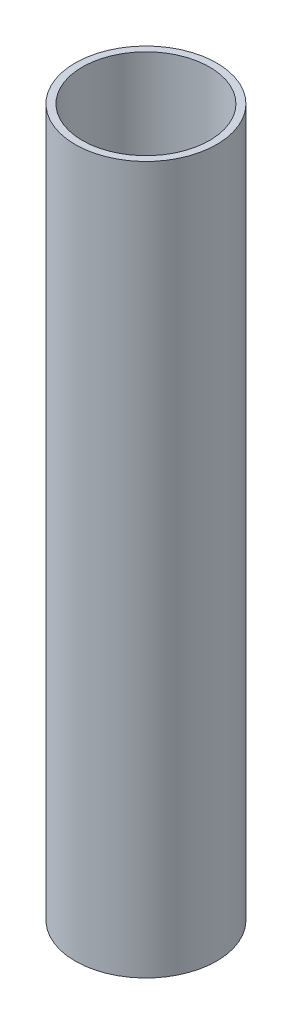
from build123d import *

# Parameters (mm, degrees)
SKETCH_1_R          = 5
EXTRUDE_1_DEPTH     = 50
SKETCH_3_R          = 4.5
CUT_EXTRUDE_1_DEPTH = 61.939229807


with BuildPart() as part:
    # 草图1 → 凸台-拉伸1 (new body)
    with BuildSketch(Plane(origin=(0, 0, 0), x_dir=(1, 0, 0), z_dir=(0, 1, 0))):
        with Locations(Location((-19.389643608, 19.874384698, 0), (0, 0, 270))):
            Circle(SKETCH_1_R)
    extrude(amount=EXTRUDE_1_DEPTH)

    # 草图3 → 切除-拉伸1 (cut, through all)
    with BuildSketch(Plane(origin=(0, 0, 0), x_dir=(1, 0, 0), z_dir=(0, 1, 0))):
        with Locations(Location((-19.389643608, 19.874384698, 0), (0, 0, 270))):
            Circle(SKETCH_3_R)
    extrude(amount=CUT_EXTRUDE_1_DEPTH, mode=Mode.SUBTRACT)


solid = part.part
